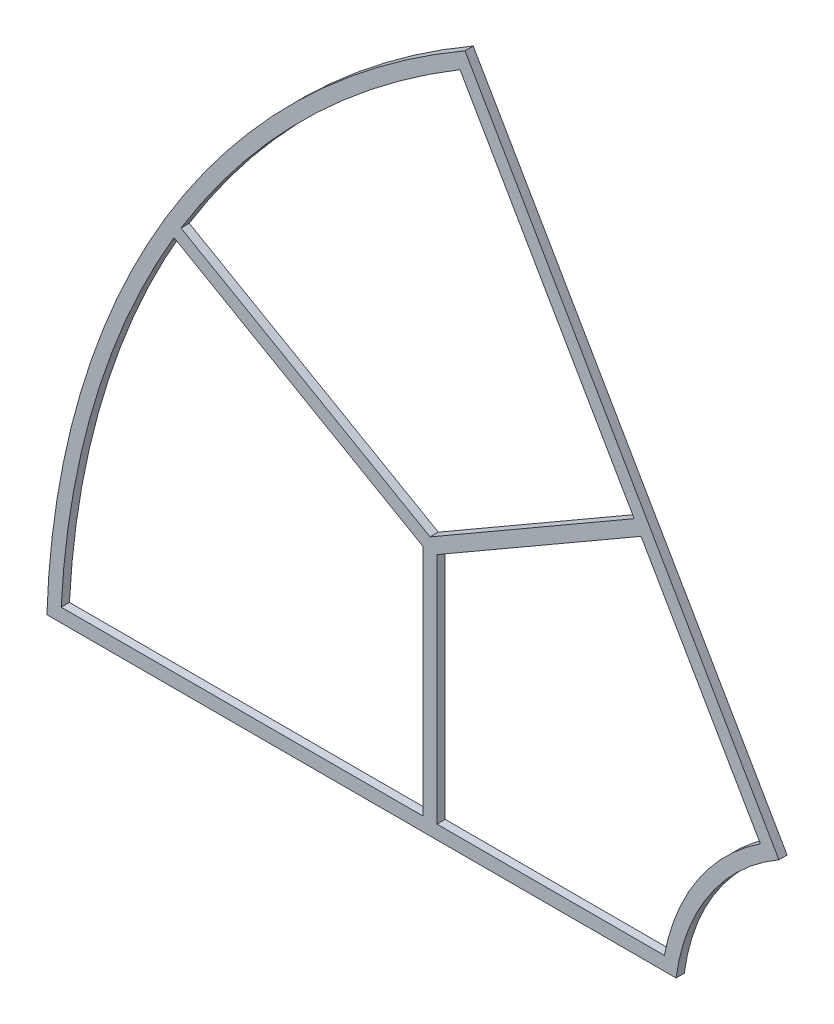
from build123d import *

# Parameters (mm, degrees)
BOSS_EXTRUDE1_DEPTH = 6


with BuildPart() as part:
    # Sketch1 → Boss-Extrude1 (new body)
    with BuildSketch(Plane.XY):
        with BuildLine():
            Line((-76.2, 131.982271537), (-304.8, 527.929086147))
            ThreePointArc((-304.8, 527.929086147), (-522.857356911, 313.420395513), (-609.271827676, 20))
            Line((-609.271827676, 20), (-151.081964509, 20))
            ThreePointArc((-151.081964509, 20), (-126.685753471, 84.714106662), (-76.2, 131.982271537))
        make_face()
        with BuildLine():
            Line((-335.2, 199.966608393), (-516.736885171, 304.143307511))
            ThreePointArc((-516.736885171, 304.143307511), (-574.388040835, 172.042258023), (-598.849029389, 30))
            Line((-598.849029389, 30), (-335.2, 30))
            Line((-335.2, 30), (-335.2, 199.966608393))
        make_face(mode=Mode.SUBTRACT)
        with BuildLine():
            Line((-330.207563047, 208.631242188), (-511.591783696, 312.720333293))
            ThreePointArc((-511.591783696, 312.720333293), (-422.199493266, 425.755502473), (-308.418556675, 514.196610158))
            Line((-308.418556675, 514.196610158), (-181.552122678, 294.457500701))
            Line((-181.552122678, 294.457500701), (-330.207563047, 208.631242188))
        make_face(mode=Mode.SUBTRACT)
        with BuildLine():
            Line((-89.706166951, 135.375638912), (-176.552122678, 285.797246663))
            Line((-176.552122678, 285.797246663), (-325.2, 199.975354677))
            Line((-325.2, 199.975354677), (-325.2, 30))
            Line((-325.2, 30), (-159.605012453, 30))
            ThreePointArc((-159.605012453, 30), (-135.333005446, 89.770471966), (-89.706166951, 135.375638912))
        make_face(mode=Mode.SUBTRACT)
    extrude(amount=BOSS_EXTRUDE1_DEPTH)


solid = part.part
